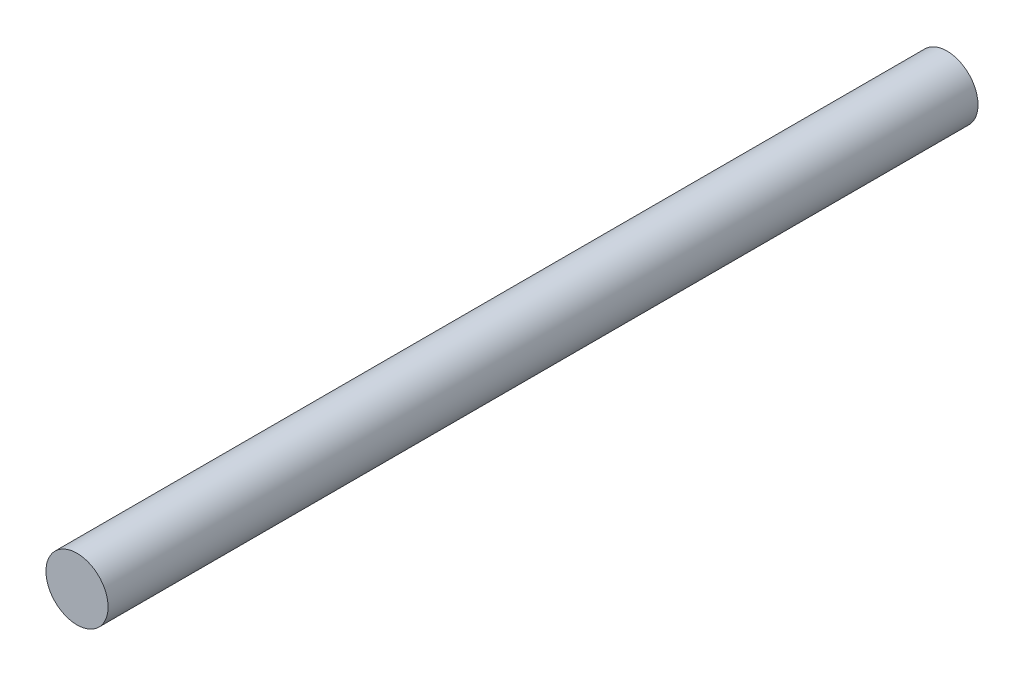
from build123d import *

# Parameters (mm, degrees)
ESQUISSE1_R        = 2.5
BOSS_EXTRU_1_DEPTH = 70


with BuildPart() as part:
    # Esquisse1 → Boss.-Extru.1 (new body)
    with BuildSketch(Plane.XY):
        Circle(ESQUISSE1_R)
    extrude(amount=BOSS_EXTRU_1_DEPTH)


solid = part.part
